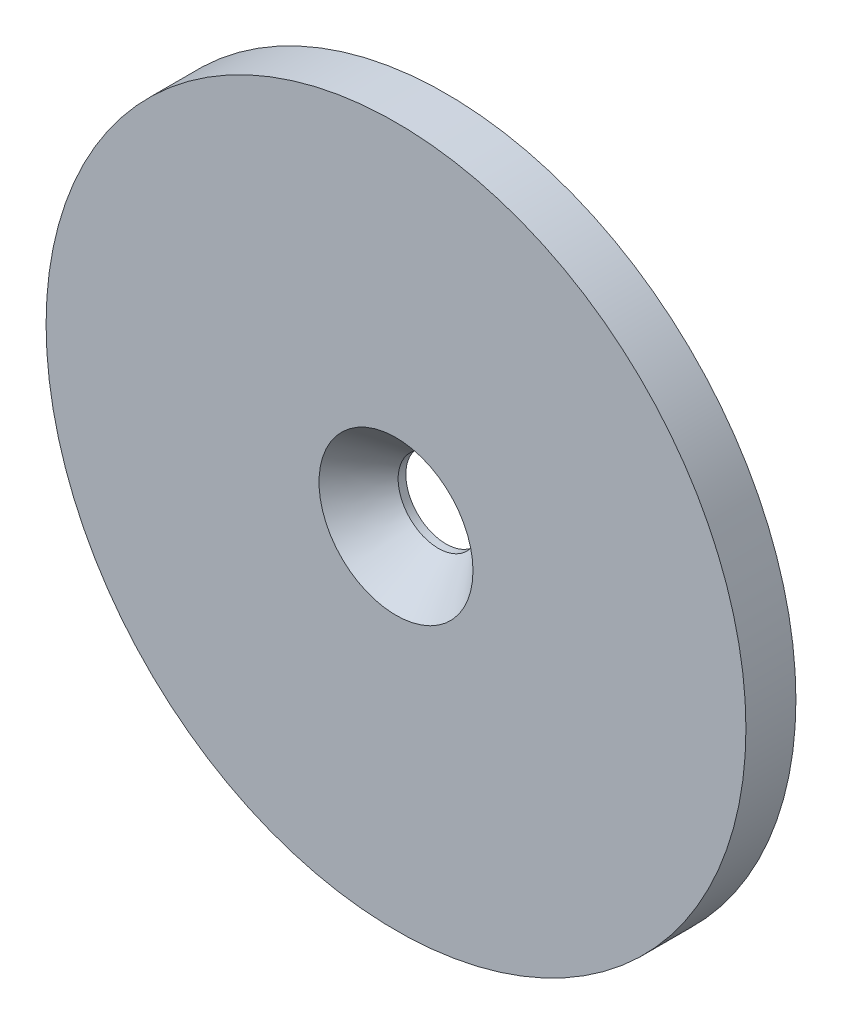
from build123d import *

# Parameters (mm, degrees)
SKETCH1_R           = 22.225
SKETCH1_R_2         = 2.4892
BOSS_EXTRUDE1_DEPTH = 3.175


with BuildPart() as part:
    # Sketch1 → Boss-Extrude1 (new body)
    with BuildSketch(Plane.XY):
        Circle(SKETCH1_R)
        Circle(SKETCH1_R_2, mode=Mode.SUBTRACT)
    extrude(amount=BOSS_EXTRUDE1_DEPTH)

    # Sketch2 → CSK for #10 Flat Head Machine Screw1 (revolve, cut)
    with BuildSketch(Plane(origin=(0, 0, 3.175), x_dir=(0, -1, 0), z_dir=(1, 0, 0))):
        Polygon((0, 0), (0, 3.175), (2.5527, 3.175), (2.5527, 2.688180894), (4.8895, 0), align=None)
    revolve(axis=Axis((0, 0, 9.525), (0, 0, -1)), mode=Mode.SUBTRACT)


solid = part.part
